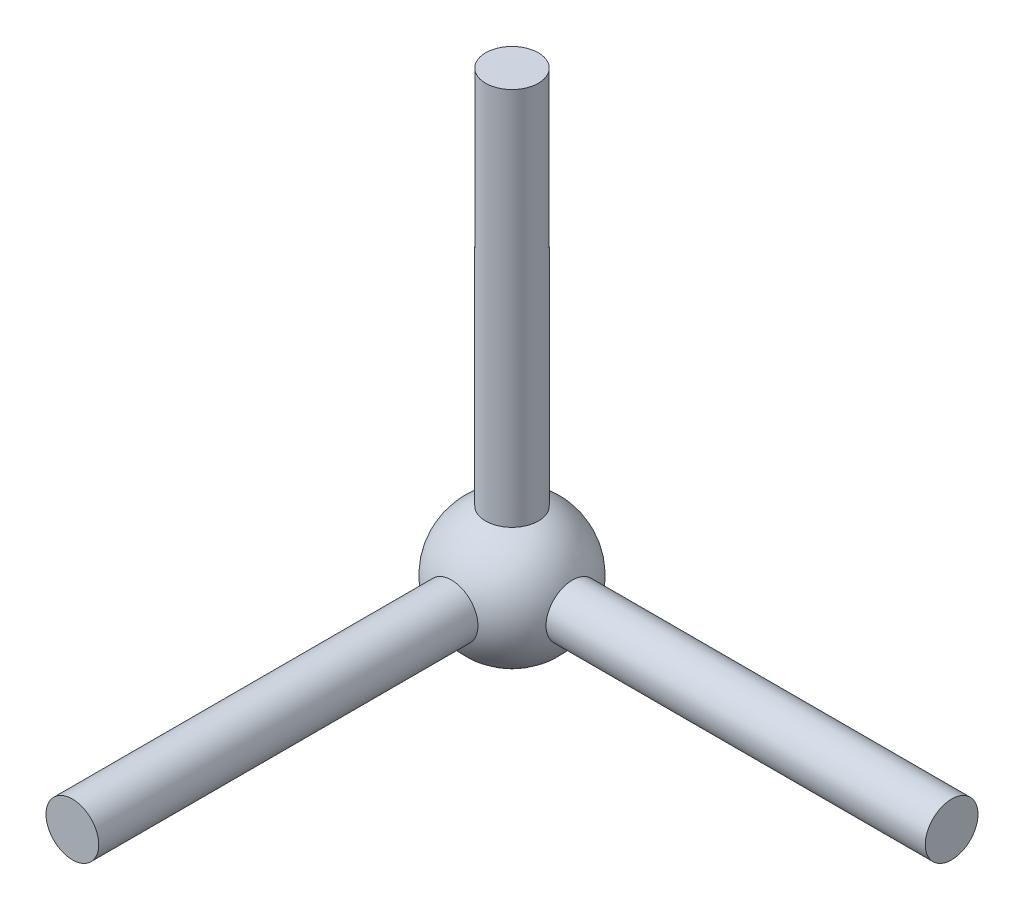
from build123d import *

# Parameters (mm, degrees)
SKETCH_5_R      = 3
EXTRUDE_1_DEPTH = 50
SKETCH_6_R      = 3
EXTRUDE_2_DEPTH = 50
SKETCH_7_R      = 3
EXTRUDE_3_DEPTH = 50


with BuildPart() as part:
    # 草图4 → 旋转10 (revolve)
    with BuildSketch(Plane.XY):
        with BuildLine():
            Line((0, -7.5), (0, 7.5))
            ThreePointArc((0, 7.5), (-7.5, 0), (0, -7.5))
        make_face()
    revolve(axis=Axis((0, -7.5, 0), (0, 1, 0)))

    # 草图5 → 凸台-拉伸1 (add)
    with BuildSketch(Plane(origin=(0, 0, 0), x_dir=(1, 0, 0), z_dir=(0, 1, 0))):
        with Locations(Location((0, 0, 0), (0, 0, 90))):
            Circle(SKETCH_5_R)
    extrude(amount=EXTRUDE_1_DEPTH)

    # 草图6 → 凸台-拉伸2 (add)
    with BuildSketch(Plane.XY):
        with Locations(Location((0, 0, 0), (0, 0, 180))):
            Circle(SKETCH_6_R)
    extrude(amount=EXTRUDE_2_DEPTH)

    # 草图7 → 凸台-拉伸3 (add)
    with BuildSketch(Plane(origin=(0, 0, 0), x_dir=(0, 0, -1), z_dir=(1, 0, 0))):
        with Locations(Location((0, 0, 0), (0, 0, 180))):
            Circle(SKETCH_7_R)
    extrude(amount=EXTRUDE_3_DEPTH)


solid = part.part
